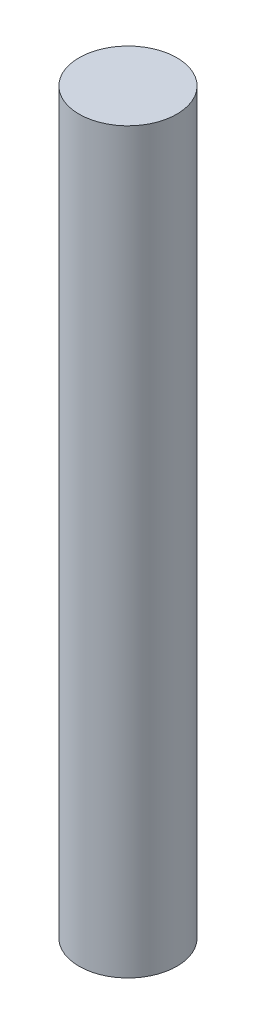
from build123d import *

# Parameters (mm, degrees)
SKETCH1_R           = 0.265
BOSS_EXTRUDE1_DEPTH = 4


with BuildPart() as part:
    # Sketch1 → Boss-Extrude1 (new body)
    with BuildSketch(Plane(origin=(0, 0, 0), x_dir=(1, 0, 0), z_dir=(0, 1, 0))):
        with Locations(Location((-72.317505081, 6.787479146, 0), (0, 0, 270))):
            Circle(SKETCH1_R)
    extrude(amount=BOSS_EXTRUDE1_DEPTH)


solid = part.part
